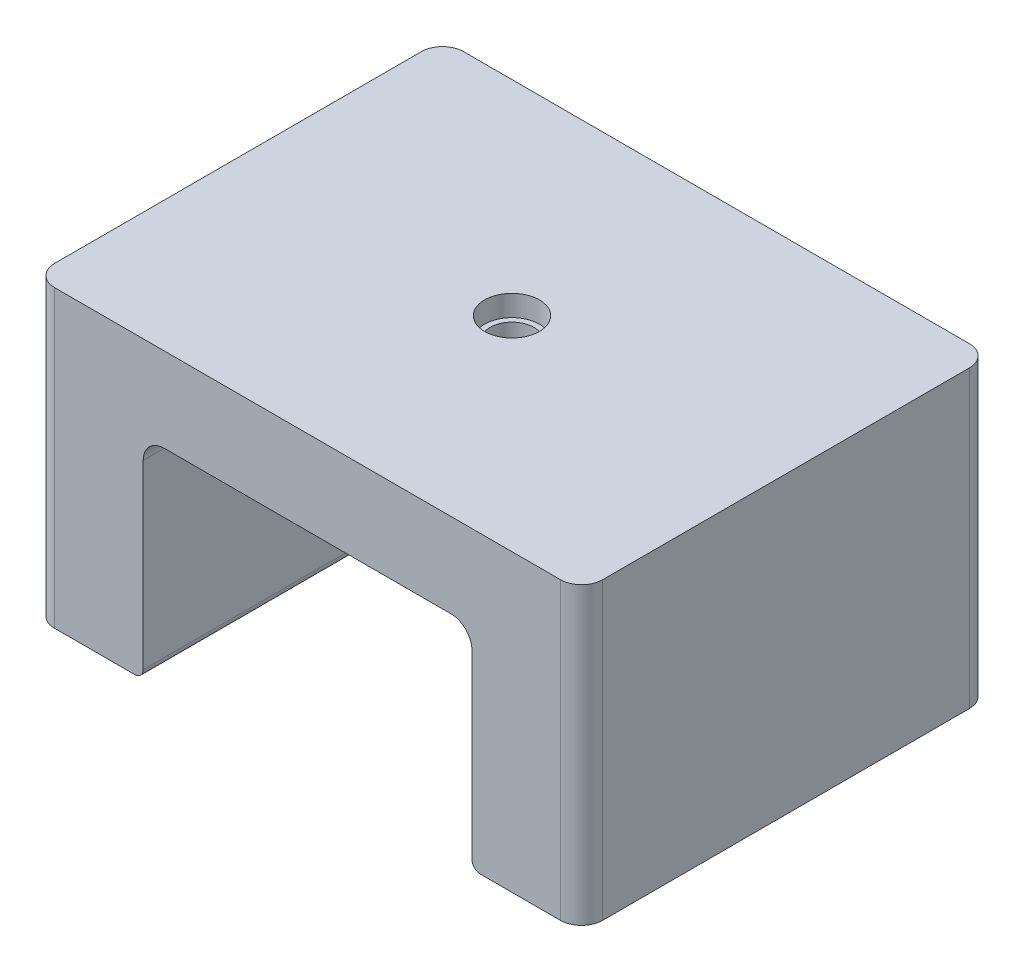
from build123d import *

# Parameters (mm, degrees)
SKETCH1_W           = 130
SKETCH1_H           = 97
BOSS_EXTRUDE1_DEPTH = 70
SKETCH2_W           = 78
SKETCH2_H           = 50
CUT_EXTRUDE1_DEPTH  = 137.1396342
FILLET3_R           = 5
SKETCH3_R           = 5.2
CUT_EXTRUDE2_DEPTH  = 108.131928014
SKETCH4_R           = 6.5
CUT_EXTRUDE3_DEPTH  = 5
FILLET2_R           = 5
FILLET4_R           = 2


with BuildPart() as part:
    # Sketch1 → Boss-Extrude1 (new body)
    with BuildSketch(Plane(origin=(0, 0, 0), x_dir=(1, 0, 0), z_dir=(0, 1, 0))):
        Rectangle(SKETCH1_W, SKETCH1_H)
    extrude(amount=BOSS_EXTRUDE1_DEPTH)

    # Sketch2 → Cut-Extrude1 (cut, through all)
    with BuildSketch(Plane.XY.offset(48.5)):
        with Locations((0, 25)):
            Rectangle(SKETCH2_W, SKETCH2_H)
    extrude(amount=-CUT_EXTRUDE1_DEPTH, mode=Mode.SUBTRACT)

    # Fillet3
    fillet3_edges = [part.edges().sort_by_distance(p)[0] for p in [
        (-39, 50, 0),
        (39, 50, 0),
    ]]
    fillet(fillet3_edges, radius=FILLET3_R)

    # Sketch3 → Cut-Extrude2 (cut, through all)
    with BuildSketch(Plane(origin=(0, 70, 0), x_dir=(1, 0, 0), z_dir=(0, 1, 0))):
        with Locations(Location((0, 0, 0), (0, 0, 270))):
            Circle(SKETCH3_R)
    extrude(amount=-CUT_EXTRUDE2_DEPTH, mode=Mode.SUBTRACT)

    # Sketch4 → Cut-Extrude3 (cut)
    with BuildSketch(Plane(origin=(0, 70, 0), x_dir=(1, 0, 0), z_dir=(0, 1, 0))):
        with Locations(Location((0, 0, 0), (0, 0, 270))):
            Circle(SKETCH4_R)
    extrude(amount=-CUT_EXTRUDE3_DEPTH, mode=Mode.SUBTRACT)

    # Fillet2
    fillet2_edges = [part.edges().sort_by_distance(p)[0] for p in [
        (-65, 35, 48.5),
        (-65, 35, -48.5),
        (65, 35, -48.5),
        (65, 35, 48.5),
    ]]
    fillet(fillet2_edges, radius=FILLET2_R)

    # Fillet4
    fillet4_edges = [part.edges().sort_by_distance(p)[0] for p in [
        (-39, 0, 0),
        (39, 0, 0),
    ]]
    fillet(fillet4_edges, radius=FILLET4_R)


solid = part.part
